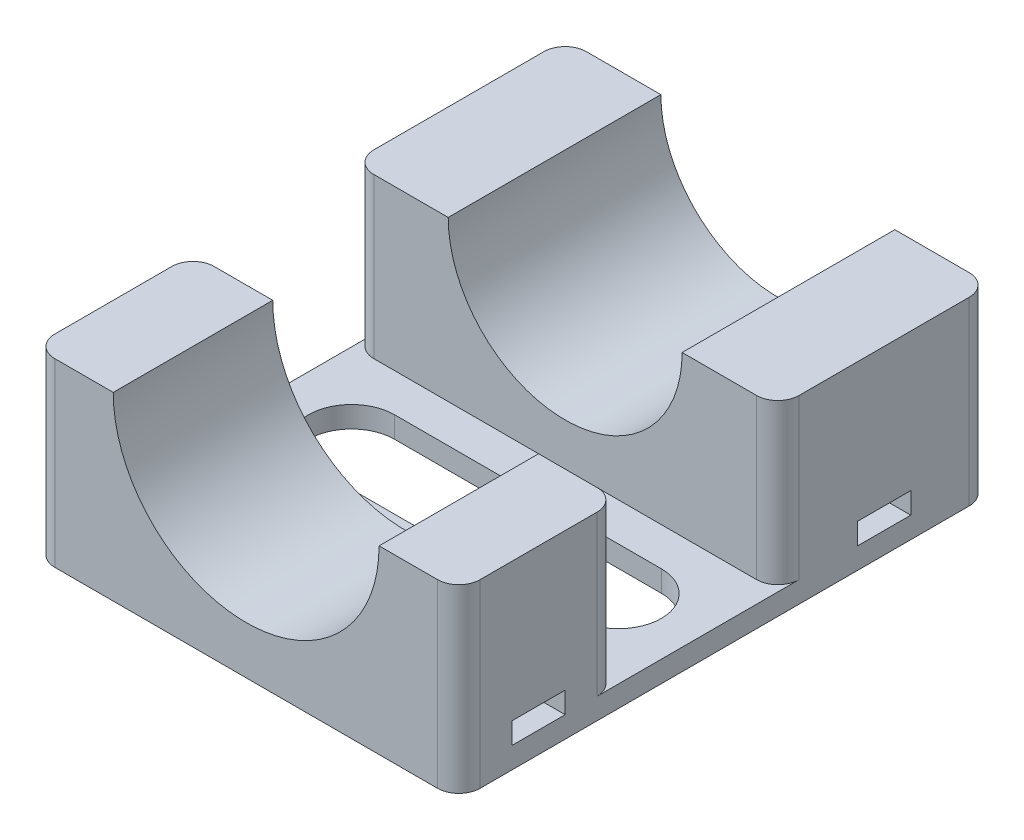
from build123d import *

# Parameters (mm, degrees)
ESBO_O1_W                = 40
ESBO_O1_H                = 50
RESSALTO_EXTRUS_O1_DEPTH = 2
ESBO_O2_W                = 40
ESBO_O2_H                = 20
ESBO_O2_H_2              = 15
RESSALTO_EXTRUS_O2_DEPTH = 15
ESBO_O3_R                = 12.5
CORTE_EXTRUS_O1_DEPTH    = 22
ESBO_O4_R                = 11
CORTE_EXTRUS_O2_DEPTH    = 22
CORTE_EXTRUS_O3_DEPTH    = 22
ESBO_O6_W                = 5
ESBO_O6_H                = 2
CORTE_EXTRUS_O4_DEPTH    = 51.139804547
FILETE1_R                = 2
FILETE2_R                = 2
FILETE3_R                = 2
FILETE4_R                = 2
FILETE5_R                = 2
FILETE6_R                = 2
FILETE7_R                = 2
FILETE8_R                = 2


with BuildPart() as part:
    # Esboço1 → Ressalto-extrusão1 (new body)
    with BuildSketch(Plane(origin=(0, 0, 0), x_dir=(1, 0, 0), z_dir=(0, 1, 0))):
        Rectangle(ESBO_O1_W, ESBO_O1_H)
    extrude(amount=RESSALTO_EXTRUS_O1_DEPTH)

    # Esboço2 → Ressalto-extrusão2 (add)
    with BuildSketch(Plane(origin=(0, 2, 0), x_dir=(1, 0, 0), z_dir=(0, 1, 0))):
        with Locations((0, 15)):
            Rectangle(ESBO_O2_W, ESBO_O2_H)
        with Locations((0, -17.5)):
            Rectangle(ESBO_O2_W, ESBO_O2_H_2)
    extrude(amount=RESSALTO_EXTRUS_O2_DEPTH)

    # Esboço3 → Corte-extrusão1 (cut)
    with BuildSketch(Plane.XY.offset(25)):
        with Locations((0, 17)):
            Circle(ESBO_O3_R)
    extrude(amount=-CORTE_EXTRUS_O1_DEPTH, mode=Mode.SUBTRACT)

    # Esboço4 → Corte-extrusão2 (cut)
    with BuildSketch(Plane(origin=(0, 0, -25), x_dir=(-1, 0, 0), z_dir=(0, 0, -1))):
        with Locations((0, 17)):
            Circle(ESBO_O4_R)
    extrude(amount=-CORTE_EXTRUS_O2_DEPTH, mode=Mode.SUBTRACT)

    # Esboço5 → Corte-extrusão3 (cut)
    with BuildSketch(Plane(origin=(0, 2, 0), x_dir=(1, 0, 0), z_dir=(0, 1, 0))):
        with BuildLine():
            Line((-12.449166755, 1.40771236), (12.633097958, 1.40771236))
            ThreePointArc((12.633097958, 1.40771236), (16.682554855, -2.641744537), (12.633097958, -6.691201435))
            Line((12.633097958, -6.691201435), (-12.449166755, -6.691201435))
            ThreePointArc((-12.449166755, -6.691201435), (-16.498623653, -2.641744537), (-12.449166755, 1.40771236))
        make_face()
    extrude(amount=-CORTE_EXTRUS_O3_DEPTH, mode=Mode.SUBTRACT)

    # Esboço6 → Corte-extrusão4 (cut, through all)
    with BuildSketch(Plane.ZY.offset(20)):
        with Locations((-15, 3)):
            Rectangle(ESBO_O6_W, ESBO_O6_H)
        with Locations((17.5, 3)):
            Rectangle(ESBO_O6_W, ESBO_O6_H)
    extrude(amount=-CORTE_EXTRUS_O4_DEPTH, mode=Mode.SUBTRACT)

    # Filete1
    filete1_edges = [part.edges().sort_by_distance(p)[0] for p in [
        (-20, 9.5, 10),
    ]]
    fillet(filete1_edges, radius=FILETE1_R)

    # Filete2
    filete2_edges = [part.edges().sort_by_distance(p)[0] for p in [
        (-20, 9.5, -5),
    ]]
    fillet(filete2_edges, radius=FILETE2_R)

    # Filete3
    filete3_edges = [part.edges().sort_by_distance(p)[0] for p in [
        (-20, 8.5, 25),
    ]]
    fillet(filete3_edges, radius=FILETE3_R)

    # Filete4
    filete4_edges = [part.edges().sort_by_distance(p)[0] for p in [
        (-20, 8.5, -25),
    ]]
    fillet(filete4_edges, radius=FILETE4_R)

    # Filete5
    filete5_edges = [part.edges().sort_by_distance(p)[0] for p in [
        (20, 8.5, -25),
    ]]
    fillet(filete5_edges, radius=FILETE5_R)

    # Filete6
    filete6_edges = [part.edges().sort_by_distance(p)[0] for p in [
        (20, 9.5, 10),
    ]]
    fillet(filete6_edges, radius=FILETE6_R)

    # Filete7
    filete7_edges = [part.edges().sort_by_distance(p)[0] for p in [
        (20, 9.5, -5),
    ]]
    fillet(filete7_edges, radius=FILETE7_R)

    # Filete8
    filete8_edges = [part.edges().sort_by_distance(p)[0] for p in [
        (20, 8.5, 25),
    ]]
    fillet(filete8_edges, radius=FILETE8_R)


solid = part.part
